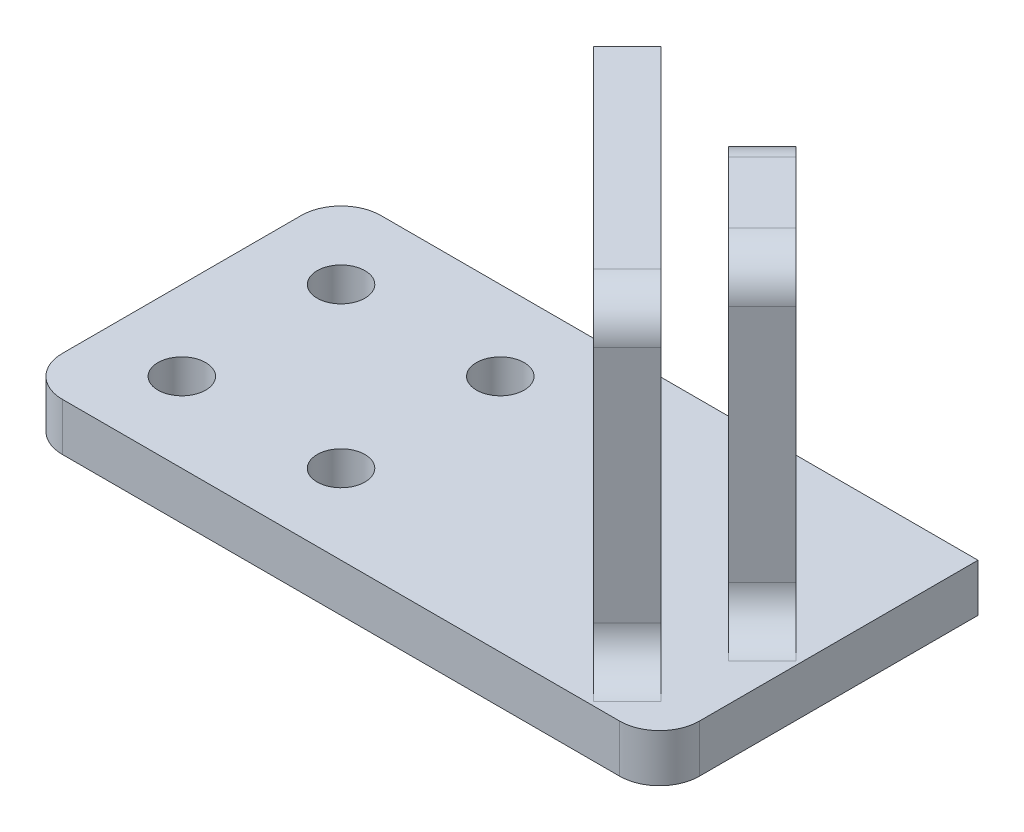
from build123d import *

# Parameters (mm, degrees)
SKETCH2_W           = 40
SKETCH2_H           = 20
SKETCH2_R           = 1.5
BOSS_EXTRUDE1_DEPTH = 3
BOSS_EXTRUDE2_DEPTH = 20
SKETCH4_R           = 1.5
CUT_EXTRUDE1_DEPTH  = 20
FILLET2_R           = 2.5


with BuildPart() as part:
    # Sketch2 → Boss-Extrude1 (new body)
    with BuildSketch(Plane(origin=(0, 0, 0), x_dir=(1, 0, 0), z_dir=(0, 1, 0))):
        with Locations((20, 10)):
            Rectangle(SKETCH2_W, SKETCH2_H)
        with Locations(Location((5, 5, 0), (0, 0, 270))):
            Circle(SKETCH2_R, mode=Mode.SUBTRACT)
        with Locations(Location((15, 5, 0), (0, 0, 270))):
            Circle(SKETCH2_R, mode=Mode.SUBTRACT)
        with Locations(Location((15, 15, 0), (0, 0, 270))):
            Circle(SKETCH2_R, mode=Mode.SUBTRACT)
        with Locations(Location((5, 15, 0), (0, 0, 270))):
            Circle(SKETCH2_R, mode=Mode.SUBTRACT)
    extrude(amount=BOSS_EXTRUDE1_DEPTH)

    # Sketch3 → Boss-Extrude2 (add)
    with BuildSketch(Plane(origin=(0, 3, 0), x_dir=(1, 0, 0), z_dir=(0, 1, 0))):
        Polygon((22.097168491, 18), (35.975848148, 4.121320344), (33.854527804, 2), (19.975848148, 15.878679656), align=None)
        Polygon((35.878679656, 8.461129522), (28.461129522, 15.878679656), (30.582449865, 18), (38, 10.582449865), align=None)
    extrude(amount=BOSS_EXTRUDE2_DEPTH)

    # Sketch4 → Cut-Extrude1 (cut)
    with BuildSketch(Plane(origin=(24.291224933, 0, -24.291224933), x_dir=(-0.7071067811865372, 0, -0.7071067811865579), z_dir=(0.7071067811865579, 0, -0.7071067811865372))):
        with Locations((-13.897135624, 18)):
            Circle(SKETCH4_R)
        with Locations((-13.897135624, 13)):
            Circle(SKETCH4_R)
        with Locations((-13.897135624, 8)):
            Circle(SKETCH4_R)
    extrude(amount=-CUT_EXTRUDE1_DEPTH, mode=Mode.SUBTRACT)

    # Fillet2
    fillet2_edges = [part.edges().sort_by_distance(p)[0] for p in [
        (34.915187976, 3, -3.060660172),
        (34.915187976, 23, -3.060660172),
        (36.939339828, 3, -9.521789694),
        (29.521789694, 3, -16.939339828),
        (36.939339828, 23, -9.521789694),
        (29.521789694, 23, -16.939339828),
        (0, 1.5, -20),
        (40, 1.5, 0),
        (0, 1.5, 0),
    ]]
    fillet(fillet2_edges, radius=FILLET2_R)


solid = part.part
